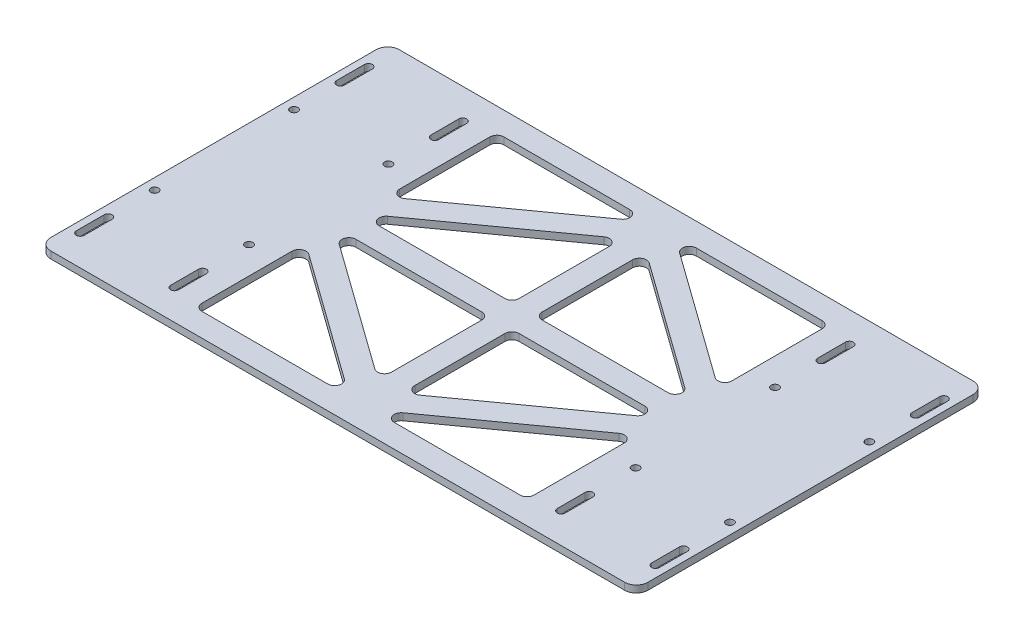
from build123d import *

# Parameters (mm, degrees)
SKETCH_1_W          = 257
SKETCH_1_H          = 150
SKETCH_1_R          = 1.65
EXTRUDE_1_DEPTH     = 3
CUT_EXTRUDE_1_DEPTH = 298.58696208
FILLET_1_R          = 3
FILLET_2_R          = 5


with BuildPart() as part:
    # 草图1 → 凸台-拉伸1 (new body)
    with BuildSketch(Plane(origin=(0, 0, 0), x_dir=(1, 0, 0), z_dir=(0, 1, 0))):
        with Locations((128.5, 75)):
            Rectangle(SKETCH_1_W, SKETCH_1_H)
        with Locations(Location((4.7, 45, 0), (0, 0, 270))):
            Circle(SKETCH_1_R, mode=Mode.SUBTRACT)
        with Locations(Location((4.7, 105, 0), (0, 0, 270))):
            Circle(SKETCH_1_R, mode=Mode.SUBTRACT)
        with Locations(Location((45.3, 45, 0), (0, 0, 270))):
            Circle(SKETCH_1_R, mode=Mode.SUBTRACT)
        with Locations(Location((45.3, 105, 0), (0, 0, 270))):
            Circle(SKETCH_1_R, mode=Mode.SUBTRACT)
        with Locations(Location((252.3, 105, 0), (0, 0, 90))):
            Circle(SKETCH_1_R, mode=Mode.SUBTRACT)
        with Locations(Location((211.7, 105, 0), (0, 0, 90))):
            Circle(SKETCH_1_R, mode=Mode.SUBTRACT)
        with Locations(Location((252.3, 45, 0), (0, 0, 90))):
            Circle(SKETCH_1_R, mode=Mode.SUBTRACT)
        with Locations(Location((211.7, 45, 0), (0, 0, 90))):
            Circle(SKETCH_1_R, mode=Mode.SUBTRACT)
        with BuildLine():
            Line((6.4, 137), (6.4, 125))
            ThreePointArc((6.4, 125), (4.7, 123.3), (3, 125))
            Line((3, 125), (3, 137))
            ThreePointArc((3, 137), (4.7, 138.7), (6.4, 137))
        make_face(mode=Mode.SUBTRACT)
        with BuildLine():
            Line((43.6, 137), (43.6, 125))
            ThreePointArc((43.6, 125), (45.3, 123.3), (47, 125))
            Line((47, 125), (47, 137))
            ThreePointArc((47, 137), (45.3, 138.7), (43.6, 137))
        make_face(mode=Mode.SUBTRACT)
        with BuildLine():
            Line((43.6, 13), (43.6, 25))
            ThreePointArc((43.6, 25), (45.3, 26.7), (47, 25))
            Line((47, 25), (47, 13))
            ThreePointArc((47, 13), (45.3, 11.3), (43.6, 13))
        make_face(mode=Mode.SUBTRACT)
        with BuildLine():
            Line((6.4, 13), (6.4, 25))
            ThreePointArc((6.4, 25), (4.7, 26.7), (3, 25))
            Line((3, 25), (3, 13))
            ThreePointArc((3, 13), (4.7, 11.3), (6.4, 13))
        make_face(mode=Mode.SUBTRACT)
        with BuildLine():
            Line((213.4, 13), (213.4, 25))
            ThreePointArc((213.4, 25), (211.7, 26.7), (210, 25))
            Line((210, 25), (210, 13))
            ThreePointArc((210, 13), (211.7, 11.3), (213.4, 13))
        make_face(mode=Mode.SUBTRACT)
        with BuildLine():
            Line((250.6, 13), (250.6, 25))
            ThreePointArc((250.6, 25), (252.3, 26.7), (254, 25))
            Line((254, 25), (254, 13))
            ThreePointArc((254, 13), (252.3, 11.3), (250.6, 13))
        make_face(mode=Mode.SUBTRACT)
        with BuildLine():
            Line((250.6, 137), (250.6, 125))
            ThreePointArc((250.6, 125), (252.3, 123.3), (254, 125))
            Line((254, 125), (254, 137))
            ThreePointArc((254, 137), (252.3, 138.7), (250.6, 137))
        make_face(mode=Mode.SUBTRACT)
        with BuildLine():
            Line((213.4, 137), (213.4, 125))
            ThreePointArc((213.4, 125), (211.7, 123.3), (210, 125))
            Line((210, 125), (210, 137))
            ThreePointArc((210, 137), (211.7, 138.7), (213.4, 137))
        make_face(mode=Mode.SUBTRACT)
    extrude(amount=EXTRUDE_1_DEPTH)

    # 草图2 → 切除-拉伸1 (cut, through all)
    with BuildSketch(Plane(origin=(0, 3, 0), x_dir=(1, 0, 0), z_dir=(0, 1, 0))):
        Polygon((57, 140), (123.5, 140), (57, 92.306014173), align=None)
        Polygon((57, 80), (123.5, 127.693985827), (123.5, 80), align=None)
        Polygon((133.5, 80), (200, 80), (133.5, 127.693985827), align=None)
        Polygon((200, 92.306014173), (200, 140), (133.5, 140), align=None)
        Polygon((200, 10), (133.5, 10), (200, 57.693985827), align=None)
        Polygon((200, 70), (133.5, 22.306014173), (133.5, 70), align=None)
        Polygon((123.5, 70), (57, 70), (123.5, 22.306014173), align=None)
        Polygon((57, 57.693985827), (57, 10), (123.5, 10), align=None)
    extrude(amount=-CUT_EXTRUDE_1_DEPTH, mode=Mode.SUBTRACT)

    # 圆角1
    fillet_1_edges = [part.edges().sort_by_distance(p)[0] for p in [
        (200, 1.5, -57.693985827),
        (200, 1.5, -10),
        (133.5, 1.5, -10),
        (200, 1.5, -92.306014173),
        (133.5, 1.5, -140),
        (200, 1.5, -140),
        (133.5, 1.5, -80),
        (133.5, 1.5, -127.693985827),
        (200, 1.5, -80),
        (123.5, 1.5, -80),
        (57, 1.5, -80),
        (123.5, 1.5, -127.693985827),
        (57, 1.5, -57.693985827),
        (123.5, 1.5, -10),
        (57, 1.5, -10),
        (123.5, 1.5, -70),
        (123.5, 1.5, -22.306014173),
        (57, 1.5, -70),
        (133.5, 1.5, -70),
        (200, 1.5, -70),
        (133.5, 1.5, -22.306014173),
        (57, 1.5, -92.306014173),
        (57, 1.5, -140),
        (123.5, 1.5, -140),
    ]]
    fillet(fillet_1_edges, radius=FILLET_1_R)

    # 圆角2
    fillet_2_edges = [part.edges().sort_by_distance(p)[0] for p in [
        (0, 1.5, -150),
        (257, 1.5, -150),
        (257, 1.5, 0),
        (0, 1.5, 0),
    ]]
    fillet(fillet_2_edges, radius=FILLET_2_R)


solid = part.part
